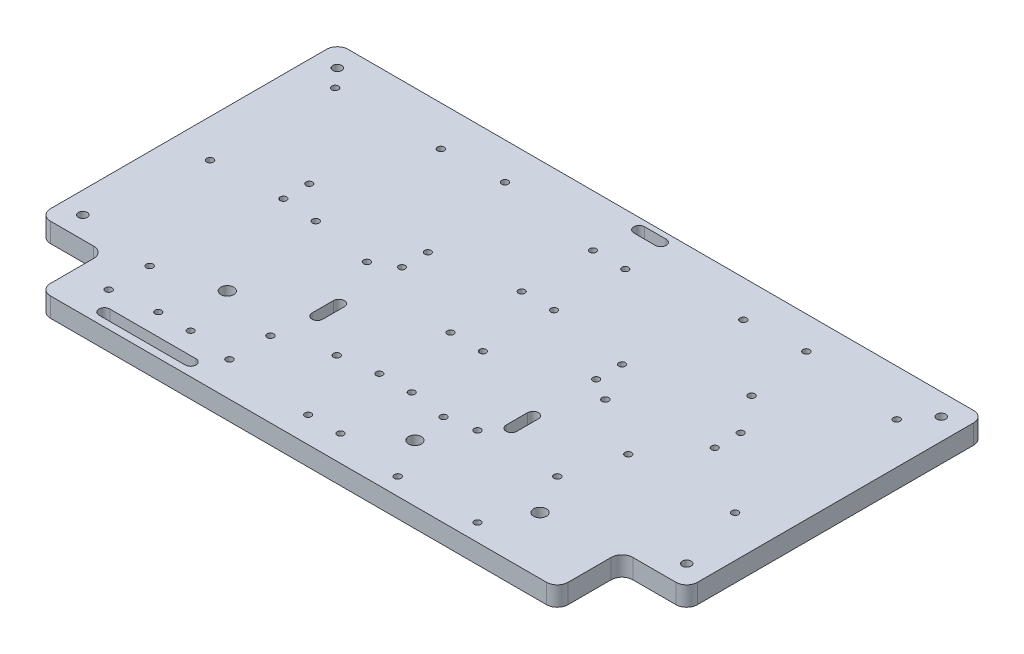
from build123d import *

# Parameters (mm, degrees)
ESQUISSE1_R             = 2.05
ESQUISSE1_R_2           = 1.55
ESQUISSE1_R_3           = 3
BOSS_EXTRU_1_DEPTH      = 9
CONG_2_R                = 5
ESQUISSE2_R             = 1.5
ENL_V_MAT_EXTRU_1_DEPTH = 10


with BuildPart() as part:
    # Esquisse1 → Boss.-Extru.1 (new body)
    with BuildSketch(Plane(origin=(0, 0, 0), x_dir=(1, 0, 0), z_dir=(0, 1, 0))):
        Polygon((150, -69), (150, 69), (-149.848840409, 69), (-150, 69), (-150, -69), (-120, -69), (-120, -99), (120, -99), (120, -69), align=None)
        with Locations(Location((-140, 59, 0), (0, 0, 270))):
            Circle(ESQUISSE1_R, mode=Mode.SUBTRACT)
        with Locations(Location((140, 59, 0), (0, 0, 90))):
            Circle(ESQUISSE1_R, mode=Mode.SUBTRACT)
        with Locations(Location((140, -59, 0), (0, 0, 270))):
            Circle(ESQUISSE1_R, mode=Mode.SUBTRACT)
        with Locations(Location((-140, -59, 0), (0, 0, 90))):
            Circle(ESQUISSE1_R, mode=Mode.SUBTRACT)
        with Locations(Location((-48, -83, 0), (0, 0, 270))):
            Circle(ESQUISSE1_R_2, mode=Mode.SUBTRACT)
        with Locations(Location((-104, -83, 0), (0, 0, 270))):
            Circle(ESQUISSE1_R_2, mode=Mode.SUBTRACT)
        with Locations(Location((-48, -64, 0), (0, 0, 270))):
            Circle(ESQUISSE1_R_2, mode=Mode.SUBTRACT)
        with Locations(Location((-104, -64, 0), (0, 0, 270))):
            Circle(ESQUISSE1_R_2, mode=Mode.SUBTRACT)
        with Locations(Location((82.54, -28.63, 0), (0, 0, 270))):
            Circle(ESQUISSE1_R_2, mode=Mode.SUBTRACT)
        with Locations(Location((130.8, -27.36, 0), (0, 0, 270))):
            Circle(ESQUISSE1_R_2, mode=Mode.SUBTRACT)
        with Locations(Location((130.8, 47.57, 0), (0, 0, 270))):
            Circle(ESQUISSE1_R_2, mode=Mode.SUBTRACT)
        with Locations(Location((82.54, 53.92, 0), (0, 0, 270))):
            Circle(ESQUISSE1_R_2, mode=Mode.SUBTRACT)
        with Locations(Location((87.62, 23.44, 0), (0, 0, 270))):
            Circle(ESQUISSE1_R_2, mode=Mode.SUBTRACT)
        with Locations(Location((38, -54, 0), (0, 0, 270))):
            Circle(ESQUISSE1_R_2, mode=Mode.SUBTRACT)
        with Locations(Location((75, -54, 0), (0, 0, 270))):
            Circle(ESQUISSE1_R_2, mode=Mode.SUBTRACT)
        with Locations(Location((75, -91, 0), (0, 0, 270))):
            Circle(ESQUISSE1_R_2, mode=Mode.SUBTRACT)
        with Locations(Location((38, -91, 0), (0, 0, 270))):
            Circle(ESQUISSE1_R_2, mode=Mode.SUBTRACT)
        with Locations(Location((-132.5, 50.5, 0), (0, 0, 270))):
            Circle(ESQUISSE1_R_2, mode=Mode.SUBTRACT)
        with Locations(Location((-132.5, -7.5, 0), (0, 0, 270))):
            Circle(ESQUISSE1_R_2, mode=Mode.SUBTRACT)
        with Locations(Location((-83.5, -7.5, 0), (0, 0, 270))):
            Circle(ESQUISSE1_R_2, mode=Mode.SUBTRACT)
        with Locations(Location((-83.5, 50.5, 0), (0, 0, 270))):
            Circle(ESQUISSE1_R_2, mode=Mode.SUBTRACT)
        with Locations(Location((-55.25, 52, 0), (0, 0, 270))):
            Circle(ESQUISSE1_R_2, mode=Mode.SUBTRACT)
        with Locations(Location((-55.25, -12, 0), (0, 0, 270))):
            Circle(ESQUISSE1_R_2, mode=Mode.SUBTRACT)
        with Locations(Location((55.25, 52, 0), (0, 0, 270))):
            Circle(ESQUISSE1_R_2, mode=Mode.SUBTRACT)
        with Locations(Location((55.25, -12, 0), (0, 0, 270))):
            Circle(ESQUISSE1_R_2, mode=Mode.SUBTRACT)
        with Locations(Location((-24.75, -56.5, 0), (0, 0, 270))):
            Circle(ESQUISSE1_R_2, mode=Mode.SUBTRACT)
        with Locations(Location((24.75, -56.5, 0), (0, 0, 270))):
            Circle(ESQUISSE1_R_2, mode=Mode.SUBTRACT)
        with Locations(Location((27.5, -72.5, 0), (0, 0, 270))):
            Circle(ESQUISSE1_R_3, mode=Mode.SUBTRACT)
        with Locations(Location((85.5, -72.5, 0), (0, 0, 270))):
            Circle(ESQUISSE1_R_3, mode=Mode.SUBTRACT)
        with Locations(Location((-76, -56, 0), (0, 0, 270))):
            Circle(ESQUISSE1_R_3, mode=Mode.SUBTRACT)
        with BuildLine():
            Line((-56, -95.5), (-96, -95.5))
            ThreePointArc((-96, -95.5), (-98.5, -93), (-96, -90.5))
            Line((-96, -90.5), (-56, -90.5))
            ThreePointArc((-56, -90.5), (-53.5, -93), (-56, -95.5))
        make_face(mode=Mode.SUBTRACT)
        with BuildLine():
            Line((-5, 66.5), (5, 66.5))
            ThreePointArc((5, 66.5), (7.5, 64), (5, 61.5))
            Line((5, 61.5), (-5, 61.5))
            ThreePointArc((-5, 61.5), (-7.5, 64), (-5, 66.5))
        make_face(mode=Mode.SUBTRACT)
        with BuildLine():
            Line((-42.5, -35.25), (-42.5, -45.25))
            ThreePointArc((-42.5, -45.25), (-45, -47.75), (-47.5, -45.25))
            Line((-47.5, -45.25), (-47.5, -35.25))
            ThreePointArc((-47.5, -35.25), (-45, -32.75), (-42.5, -35.25))
        make_face(mode=Mode.SUBTRACT)
        with BuildLine():
            Line((42.5, -35.25), (42.5, -45.25))
            ThreePointArc((42.5, -45.25), (45, -47.75), (47.5, -45.25))
            Line((47.5, -45.25), (47.5, -35.25))
            ThreePointArc((47.5, -35.25), (45, -32.75), (42.5, -35.25))
        make_face(mode=Mode.SUBTRACT)
    extrude(amount=BOSS_EXTRU_1_DEPTH)

    # Congé2
    cong_2_edges = [part.edges().sort_by_distance(p)[0] for p in [
        (150, 4.5, -69),
        (150, 4.5, 69),
        (120, 4.5, 69),
        (120, 4.5, 99),
        (-120, 4.5, 99),
        (-120, 4.5, 69),
        (-150, 4.5, 69),
        (-150, 4.5, -69),
    ]]
    fillet(cong_2_edges, radius=CONG_2_R)

    # Esquisse2 → Enlèv. mat.-Extru.1 (cut)
    with BuildSketch(Plane(origin=(0, 9, 0), x_dir=(1, 0, 0), z_dir=(0, 1, 0))):
        with Locations(Location((-7.5, 45, 0), (0, 0, 270))):
            Circle(ESQUISSE2_R)
        with Locations(Location((7.5, 45, 0), (0, 0, 90))):
            Circle(ESQUISSE2_R)
        with Locations(Location((-7.5, 12, 0), (0, 0, 270))):
            Circle(ESQUISSE2_R)
        with Locations(Location((7.5, 12, 0), (0, 0, 90))):
            Circle(ESQUISSE2_R)
        with Locations(Location((-7.5, -21, 0), (0, 0, 270))):
            Circle(ESQUISSE2_R)
        with Locations(Location((7.5, -21, 0), (0, 0, 90))):
            Circle(ESQUISSE2_R)
        with Locations(Location((-7.5, -54, 0), (0, 0, 270))):
            Circle(ESQUISSE2_R)
        with Locations(Location((7.5, -54, 0), (0, 0, 90))):
            Circle(ESQUISSE2_R)
        with Locations(Location((-7.5, -87, 0), (0, 0, 270))):
            Circle(ESQUISSE2_R)
        with Locations(Location((7.5, -87, 0), (0, 0, 90))):
            Circle(ESQUISSE2_R)
        with Locations(Location((-100, 6, 0), (0, 0, 270))):
            Circle(ESQUISSE2_R)
        with Locations(Location((-100, -6, 0), (0, 0, 90))):
            Circle(ESQUISSE2_R)
        with Locations(Location((100, -6, 0), (0, 0, 270))):
            Circle(ESQUISSE2_R)
        with Locations(Location((100, 6, 0), (0, 0, 90))):
            Circle(ESQUISSE2_R)
        with Locations(Location((-83.5, -80.5, 0), (0, 0, 270))):
            Circle(ESQUISSE2_R)
        with Locations(Location((-68.5, -80.5, 0), (0, 0, 90))):
            Circle(ESQUISSE2_R)
        with Locations(Location((-45, -6, 0), (0, 0, 90))):
            Circle(ESQUISSE2_R)
        with Locations(Location((-45, 6, 0), (0, 0, 270))):
            Circle(ESQUISSE2_R)
        with Locations(Location((45, 6, 0), (0, 0, 90))):
            Circle(ESQUISSE2_R)
        with Locations(Location((45, -6, 0), (0, 0, 270))):
            Circle(ESQUISSE2_R)
    extrude(amount=-ENL_V_MAT_EXTRU_1_DEPTH, mode=Mode.SUBTRACT)


solid = part.part
